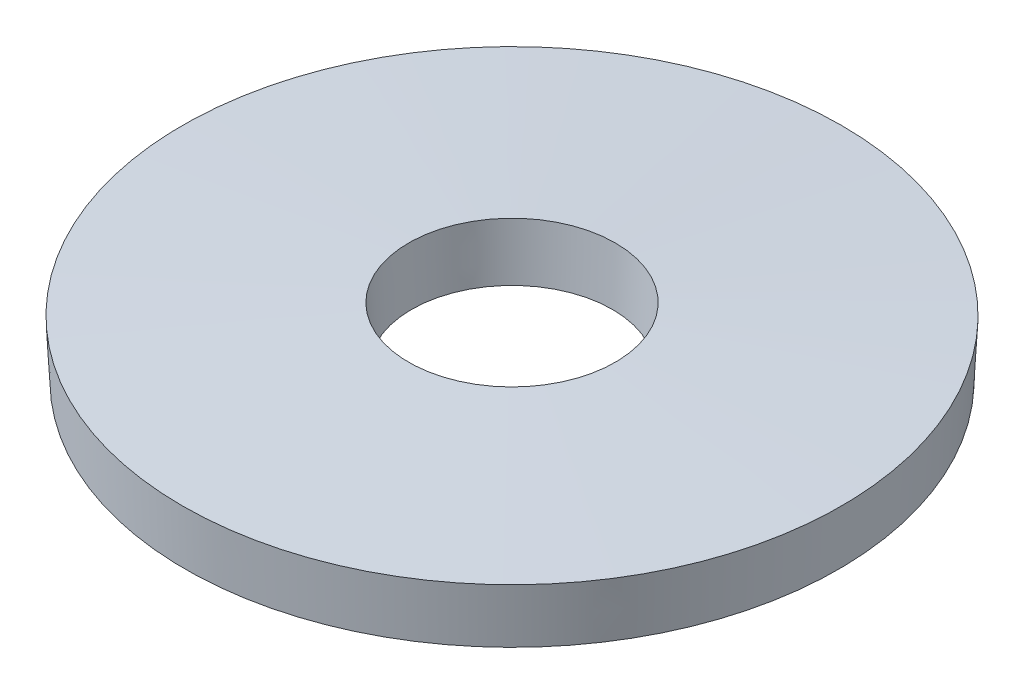
from build123d import *


with BuildPart() as part:
    # Sketch1 → Revolve1 (revolve)
    with BuildSketch(Plane(origin=(0, 0, 0), x_dir=(0, 0, -1), z_dir=(1, 0, 0)), mode=Mode.PRIVATE) as revolve1_sk:
        Polygon((-20.6375, 0), (-6.35, 0.715652536), (-6.52789494, 4.2672), (-20.81539494, 3.551547464), align=None)
    revolve(revolve1_sk.sketch.rotate(Axis((0, 0, 0), (0, 1, 0)), 180), axis=Axis((0, 0, 0), (0, 1, 0)))


solid = part.part
